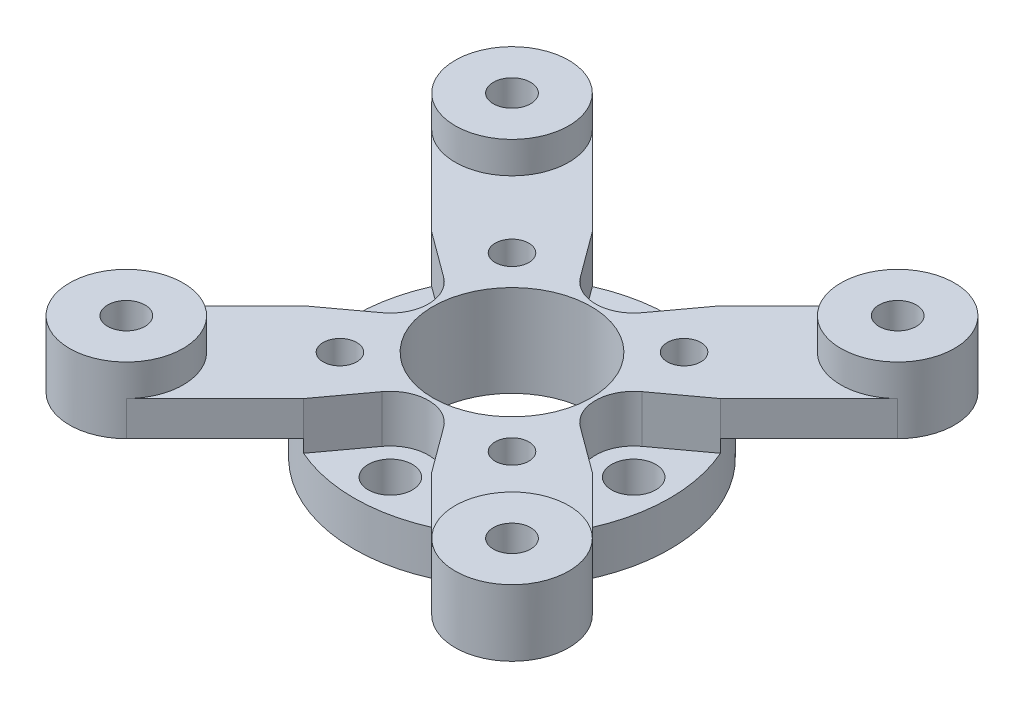
from build123d import *

# Parameters (mm, degrees)
SKETCH1_W                                          = 12.69619
SKETCH1_H                                          = 3.556
BOSS_EXTRUDE1_START                                = 1.016
BOSS_EXTRUDE1_DEPTH                                = 1.016
BOSS_EXTRUDE2_START                                = 2.794
BOSS_EXTRUDE2_DEPTH                                = 2.794
BOSS_EXTRUDE3_START                                = 2.54
SKETCH4_R                                          = 4.56565
BOSS_EXTRUDE3_DEPTH                                = 2.54
BOSS_EXTRUDE4_START                                = 2.54
SKETCH5_R                                          = 4.56565
BOSS_EXTRUDE4_DEPTH                                = 2.54
BOSS_EXTRUDE5_START                                = 2.54
SKETCH6_R                                          = 4.56565
BOSS_EXTRUDE5_DEPTH                                = 2.54
BOSS_EXTRUDE6_START                                = 2.54
SKETCH7_R                                          = 4.56565
BOSS_EXTRUDE6_DEPTH                                = 2.54
HOLE1_D                                            = 12.7254
M2_5_CLEARANCE_HOLE1_D                             = 2.7051
M3_CLEARANCE_HOLE1_D                               = 3.556
CBORE_FOR_M2_5_HEX_HEAD_MACHINE_SCREW1_D           = 3
CBORE_FOR_M2_5_HEX_HEAD_MACHINE_SCREW1_CBORE_D     = 6.35
CBORE_FOR_M2_5_HEX_HEAD_MACHINE_SCREW1_CBORE_DEPTH = 3.048


with BuildPart() as part:
    # Sketch1 → Revolve1 (revolve)
    with BuildSketch(Plane.XY, mode=Mode.PRIVATE) as revolve1_sk:
        with Locations((6.348095, 1.778)):
            Rectangle(SKETCH1_W, SKETCH1_H)
    revolve(revolve1_sk.sketch.rotate(Axis((0, 3.556, 0), (0, -1, 0)), 270), axis=Axis((0, 3.556, 0), (0, -1, 0)))

    # Sketch2 → Boss-Extrude1 (add)
    with BuildSketch(Plane(origin=(0, 3.556, 0), x_dir=(-1, 0, 0), z_dir=(0, 1, 0)).offset(BOSS_EXTRUDE1_START)):
        with BuildLine():
            Line((2.47008, 7.962716), (5.148593, 11.605397))
            ThreePointArc((5.148593, 11.605397), (8.977562, 8.977562), (11.605397, 5.148593))
            Line((11.605397, 5.148593), (7.962716, 2.47008))
            ThreePointArc((7.962716, 2.47008), (6.713028, 0), (7.962716, -2.47008))
            Line((7.962716, -2.47008), (11.605397, -5.148593))
            ThreePointArc((11.605397, -5.148593), (8.977562, -8.977562), (5.148593, -11.605397))
            Line((5.148593, -11.605397), (2.47008, -7.962716))
            ThreePointArc((2.47008, -7.962716), (0, -6.713028), (-2.47008, -7.962716))
            Line((-2.47008, -7.962716), (-5.148593, -11.605397))
            ThreePointArc((-5.148593, -11.605397), (-8.977562, -8.977562), (-11.605397, -5.148593))
            Line((-11.605397, -5.148593), (-7.962716, -2.47008))
            ThreePointArc((-7.962716, -2.47008), (-6.713028, 0), (-7.962716, 2.47008))
            Line((-7.962716, 2.47008), (-11.605397, 5.148593))
            ThreePointArc((-11.605397, 5.148593), (-8.977562, 8.977562), (-5.148593, 11.605397))
            Line((-5.148593, 11.605397), (-2.47008, 7.962716))
            ThreePointArc((-2.47008, 7.962716), (0, 6.713028), (2.47008, 7.962716))
        make_face()
    extrude(amount=-BOSS_EXTRUDE1_DEPTH)

    # Sketch3 → Boss-Extrude2 (add)
    with BuildSketch(Plane(origin=(0, 4.572, 0), x_dir=(-1, 0, 0), z_dir=(0, 1, 0)).offset(BOSS_EXTRUDE2_START)):
        with BuildLine():
            Line((-7.962716, 2.47008), (-11.605397, 5.148593))
            Line((-11.605397, 5.148593), (-18.728402, 12.271598))
            ThreePointArc((-18.728402, 12.271598), (-18.728402, 18.728402), (-12.271598, 18.728402))
            Line((-12.271598, 18.728402), (-5.148593, 11.605397))
            Line((-5.148593, 11.605397), (-2.47008, 7.962716))
            ThreePointArc((-2.47008, 7.962716), (0, 6.713028), (2.47008, 7.962716))
            Line((2.47008, 7.962716), (5.148593, 11.605397))
            Line((5.148593, 11.605397), (12.271598, 18.728402))
            ThreePointArc((12.271598, 18.728402), (18.728402, 18.728402), (18.728402, 12.271598))
            Line((18.728402, 12.271598), (11.605397, 5.148593))
            Line((11.605397, 5.148593), (7.962716, 2.47008))
            ThreePointArc((7.962716, 2.47008), (6.713028, 0), (7.962716, -2.47008))
            Line((7.962716, -2.47008), (11.605397, -5.148593))
            Line((11.605397, -5.148593), (18.728402, -12.271598))
            ThreePointArc((18.728402, -12.271598), (18.728402, -18.728402), (12.271598, -18.728402))
            Line((12.271598, -18.728402), (5.148593, -11.605397))
            Line((5.148593, -11.605397), (2.47008, -7.962716))
            ThreePointArc((2.47008, -7.962716), (0, -6.713028), (-2.47008, -7.962716))
            Line((-2.47008, -7.962716), (-5.148593, -11.605397))
            Line((-5.148593, -11.605397), (-12.271598, -18.728402))
            ThreePointArc((-12.271598, -18.728402), (-18.728402, -18.728402), (-18.728402, -12.271598))
            Line((-18.728402, -12.271598), (-11.605397, -5.148593))
            Line((-11.605397, -5.148593), (-7.962716, -2.47008))
            ThreePointArc((-7.962716, -2.47008), (-6.713028, 0), (-7.962716, 2.47008))
        make_face()
    extrude(amount=-BOSS_EXTRUDE2_DEPTH)

    # Sketch4 → Boss-Extrude3 (add)
    with BuildSketch(Plane(origin=(0, 7.366, 0), x_dir=(-1, 0, 0), z_dir=(0, 1, 0)).offset(BOSS_EXTRUDE3_START)):
        with Locations(Location((-15.5, -15.5, 0), (0, 0, 315))):
            Circle(SKETCH4_R)
    extrude(amount=-BOSS_EXTRUDE3_DEPTH)

    # Sketch5 → Boss-Extrude4 (add)
    with BuildSketch(Plane(origin=(0, 7.366, 0), x_dir=(-1, 0, 0), z_dir=(0, 1, 0)).offset(BOSS_EXTRUDE4_START)):
        with Locations(Location((15.5, -15.5, 0), (0, 0, 225))):
            Circle(SKETCH5_R)
    extrude(amount=-BOSS_EXTRUDE4_DEPTH)

    # Sketch6 → Boss-Extrude5 (add)
    with BuildSketch(Plane(origin=(0, 7.366, 0), x_dir=(-1, 0, 0), z_dir=(0, 1, 0)).offset(BOSS_EXTRUDE5_START)):
        with Locations(Location((15.5, 15.5, 0), (0, 0, 315))):
            Circle(SKETCH6_R)
    extrude(amount=-BOSS_EXTRUDE5_DEPTH)

    # Sketch7 → Boss-Extrude6 (add)
    with BuildSketch(Plane(origin=(0, 7.366, 0), x_dir=(-1, 0, 0), z_dir=(0, 1, 0)).offset(BOSS_EXTRUDE6_START)):
        with Locations(Location((-15.5, 15.5, 0), (0, 0, 225))):
            Circle(SKETCH7_R)
    extrude(amount=-BOSS_EXTRUDE6_DEPTH)

    # Hole1 (through all)
    with Locations(Plane(origin=(0, 7.366, 0), x_dir=(1, 0, 0), z_dir=(0, 1, 0))):
        with Locations((0, 0)):
            Hole(HOLE1_D / 2)

    # M2.5 Clearance Hole1 (through all)
    with Locations(Plane(origin=(0, 7.366, 0), x_dir=(1, 0, 0), z_dir=(0, 1, 0))):
        with Locations((6.914797, -6.914797), (-6.914797, 6.914797), (6.914797, 6.914797), (-6.914797, -6.914797)):
            Hole(M2_5_CLEARANCE_HOLE1_D / 2)

    # M3 Clearance Hole1 (through all)
    with Locations(Plane(origin=(0, 3.556, 0), x_dir=(1, 0, 0), z_dir=(0, 1, 0))):
        with Locations((0, -9.779), (-9.779, 0), (0, 9.779), (9.779, 0)):
            Hole(M3_CLEARANCE_HOLE1_D / 2)

    # CBORE for M2.5 Hex Head Machine Screw1 (through all)
    with Locations(Plane(origin=(0, 4.572, 0), x_dir=(-1, 0, 0), z_dir=(0, -1, 0))):
        with Locations((-15.5, 15.5), (15.5, 15.5), (15.5, -15.5), (-15.5, -15.5)):
            CounterBoreHole(CBORE_FOR_M2_5_HEX_HEAD_MACHINE_SCREW1_D / 2, CBORE_FOR_M2_5_HEX_HEAD_MACHINE_SCREW1_CBORE_D / 2, CBORE_FOR_M2_5_HEX_HEAD_MACHINE_SCREW1_CBORE_DEPTH)


solid = part.part
